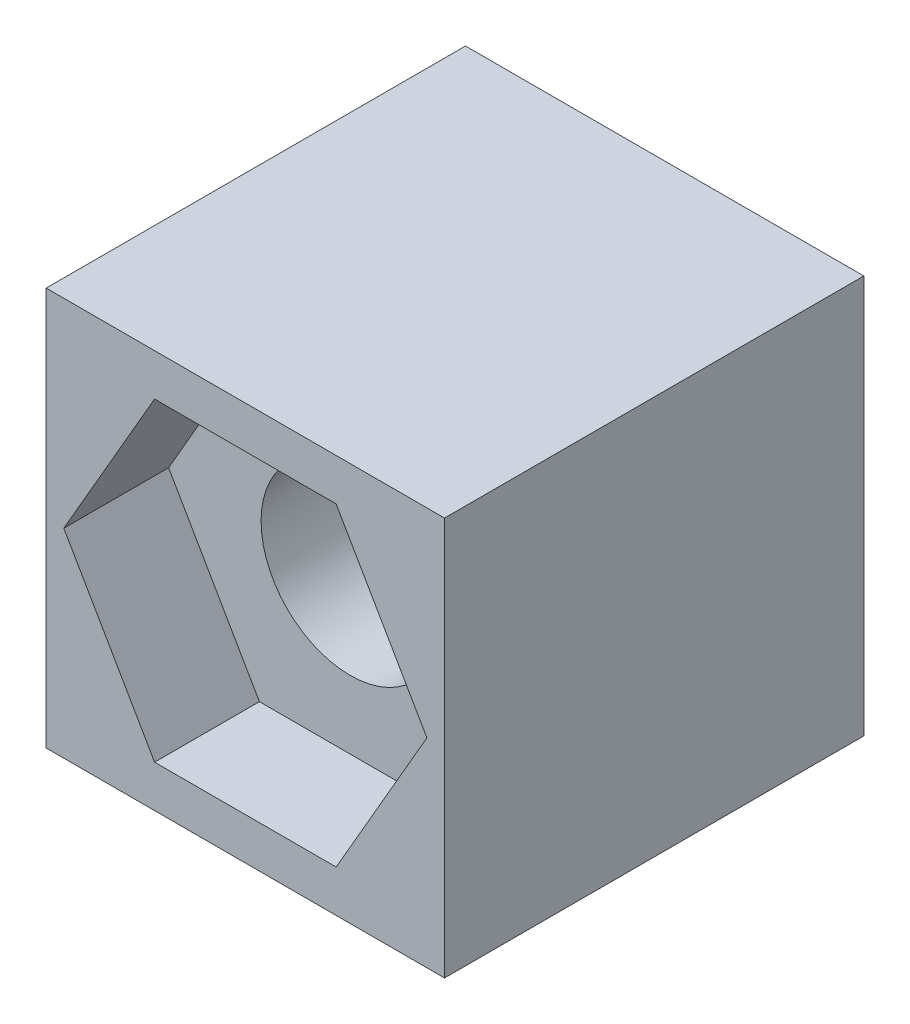
from build123d import *

# Parameters (mm, degrees)
SKETCH1_W           = 7.6
SKETCH1_H           = 7.6
SKETCH1_R           = 1.7
BOSS_EXTRUDE1_DEPTH = 8
CUT_EXTRUDE1_DEPTH  = 2


with BuildPart() as part:
    # Sketch1 → Boss-Extrude1 (new body)
    with BuildSketch(Plane.XY):
        with Locations((3.8, 3.8)):
            Rectangle(SKETCH1_W, SKETCH1_H)
        with Locations((3.8, 3.8)):
            Circle(SKETCH1_R, mode=Mode.SUBTRACT)
    extrude(amount=BOSS_EXTRUDE1_DEPTH)

    # Sketch3 → Cut-Extrude1 (cut)
    with BuildSketch(Plane.XY.offset(8)):
        Polygon((5.532050808, 0.8), (7.264101615, 3.8), (5.532050808, 6.8), (2.067949192, 6.8), (0.335898385, 3.8), (2.067949192, 0.8), align=None)
    extrude(amount=-CUT_EXTRUDE1_DEPTH, mode=Mode.SUBTRACT)


solid = part.part
